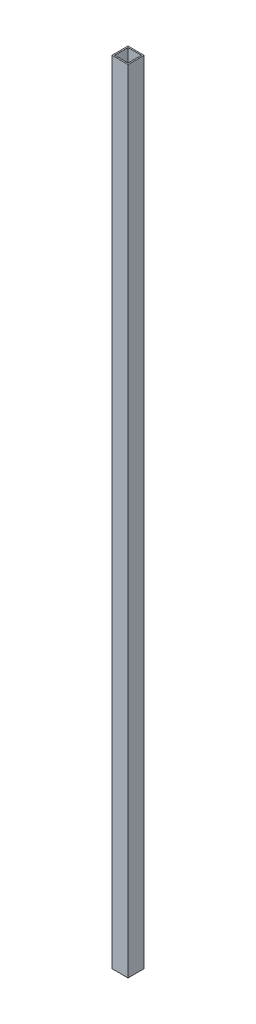
from build123d import *

# Parameters (mm, degrees)
SKETCH1_W           = 19.05
SKETCH1_H           = 19.05
SKETCH1_W_2         = 15.875
SKETCH1_H_2         = 15.875
BOSS_EXTRUDE1_DEPTH = 939.8


with BuildPart() as part:
    # Sketch1 → Boss-Extrude1 (new body)
    with BuildSketch(Plane(origin=(0, 0, 0), x_dir=(1, 0, 0), z_dir=(0, 1, 0))):
        with Locations((9.525, 9.525)):
            Rectangle(SKETCH1_W, SKETCH1_H)
        with Locations((9.525, 9.525)):
            Rectangle(SKETCH1_W_2, SKETCH1_H_2, mode=Mode.SUBTRACT)
    extrude(amount=BOSS_EXTRUDE1_DEPTH)


solid = part.part
